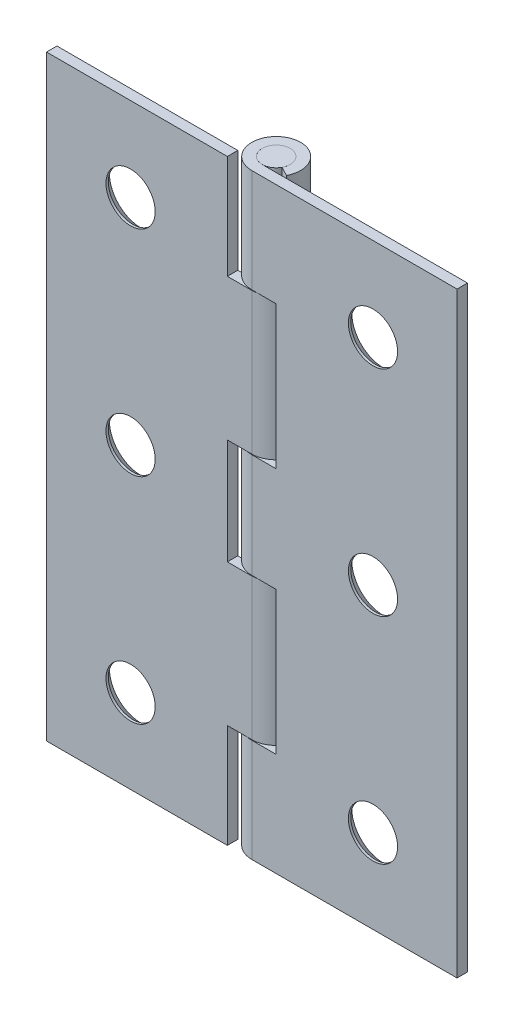
from build123d import *

# Parameters (mm, degrees)
EXTRUDE1_DEPTH          = 25.4
LPATTERN2_COUNT         = 3
LPATTERN2_PITCH         = 18.25625
CUT_EXTRUDE1_DEPTH      = 31.900929681
CUT_EXTRUDE1_DEPTH_BACK = 31.900929681
SKETCH4_W               = 4.15925
SKETCH4_H               = 12.1666
CUT_EXTRUDE2_DEPTH      = 31.900929681
CUT_EXTRUDE2_DEPTH_BACK = 31.900929681
SKETCH5_W               = 4.15925
SKETCH5_H               = 8.8392
SKETCH5_H_2             = 8.9916
EXTRUDE2_START          = -25.4
SKETCH6_R               = 1.188085
EXTRUDE2_DEPTH          = 50.8


with BuildPart() as part:
    # Sketch1 → Extrude1 (new, symmetric)
    with BuildSketch(Plane(origin=(0, 0, 0), x_dir=(1, 0, 0), z_dir=(0, 1, 0))):
        with BuildLine():
            Line((0, -1.190625), (17.4752, -1.190625))
            Line((17.4752, -1.190625), (17.4752, -2.079625))
            Line((17.4752, -2.079625), (0, -2.079625))
            ThreePointArc((0, -2.079625), (-1.074937971, 1.780266413), (1.840404847, -0.968375))
            Line((1.840404847, -0.968375), (1.053666897, -0.554413168))
            ThreePointArc((1.053666897, -0.554413168), (-0.615422502, 1.019236496), (0, -1.190625))
        make_face()
    extrude(amount=EXTRUDE1_DEPTH, both=True)

    # Sketch7 → Cut-Revolve1 (revolve, cut)
    with BuildSketch(Plane(origin=(10.31875, 0, 0), x_dir=(0, 0, -1), z_dir=(1, 0, 0)), mode=Mode.PRIVATE) as cut_revolve1_sk:
        Polygon((-1.190625, 18.25625), (-1.190625, 20.94865), (-1.877279902, 20.35175), (-2.079625, 20.35175), (-2.079625, 18.25625), align=None)
    cut_revolve1 = revolve(cut_revolve1_sk.sketch.rotate(Axis((10.31875, 18.25625, -1.822321443), (0, 0, 1)), 90), axis=Axis((10.31875, 18.25625, -1.822321443), (0, 0, 1)), mode=Mode.SUBTRACT)

    # LPattern2: Cut-Revolve1 ×3
    with Locations(*[(0, -i * LPATTERN2_PITCH, 0) for i in range(1, LPATTERN2_COUNT)]):
        add(cut_revolve1, mode=Mode.SUBTRACT)


with BuildPart() as body_2:
    # Mirror2: mirrored copy
    add(part.part.mirror(Plane(origin=(0, 0, 0), x_dir=(0, 0, 1), z_dir=(1, 0, 0))))

    # Sketch5 → Cut-Extrude2 (cut, two sides: drawn at the far end of the back side and taken through both)
    with BuildSketch(Plane.XY.offset(-CUT_EXTRUDE2_DEPTH_BACK)):
        with Locations((0, -20.9804)):
            Rectangle(SKETCH5_W, SKETCH5_H)
        Rectangle(SKETCH5_W, SKETCH5_H_2)
        with Locations((0, 20.9804)):
            Rectangle(SKETCH5_W, SKETCH5_H)
    extrude(amount=CUT_EXTRUDE2_DEPTH + CUT_EXTRUDE2_DEPTH_BACK, mode=Mode.SUBTRACT)


with BuildPart() as part_1:
    add(part.part)

    # Sketch4 → Cut-Extrude1 (cut, two sides: drawn at the far end of the back side and taken through both)
    with BuildSketch(Plane.XY.offset(-CUT_EXTRUDE1_DEPTH_BACK)):
        with Locations((0, 10.5283)):
            Rectangle(SKETCH4_W, SKETCH4_H)
        with Locations((0, -10.5283)):
            Rectangle(SKETCH4_W, SKETCH4_H)
    extrude(amount=CUT_EXTRUDE1_DEPTH + CUT_EXTRUDE1_DEPTH_BACK, mode=Mode.SUBTRACT)


with BuildPart() as body_3:
    # Sketch6 → Extrude2 (new body)
    with BuildSketch(Plane(origin=(0, 0, 0), x_dir=(1, 0, 0), z_dir=(0, 1, 0)).offset(EXTRUDE2_START)):
        with Locations(Location((0, 0, 0), (0, 0, 270))):
            Circle(SKETCH6_R)
    extrude(amount=EXTRUDE2_DEPTH)


solid = Compound([body_2.part, part_1.part, body_3.part])
